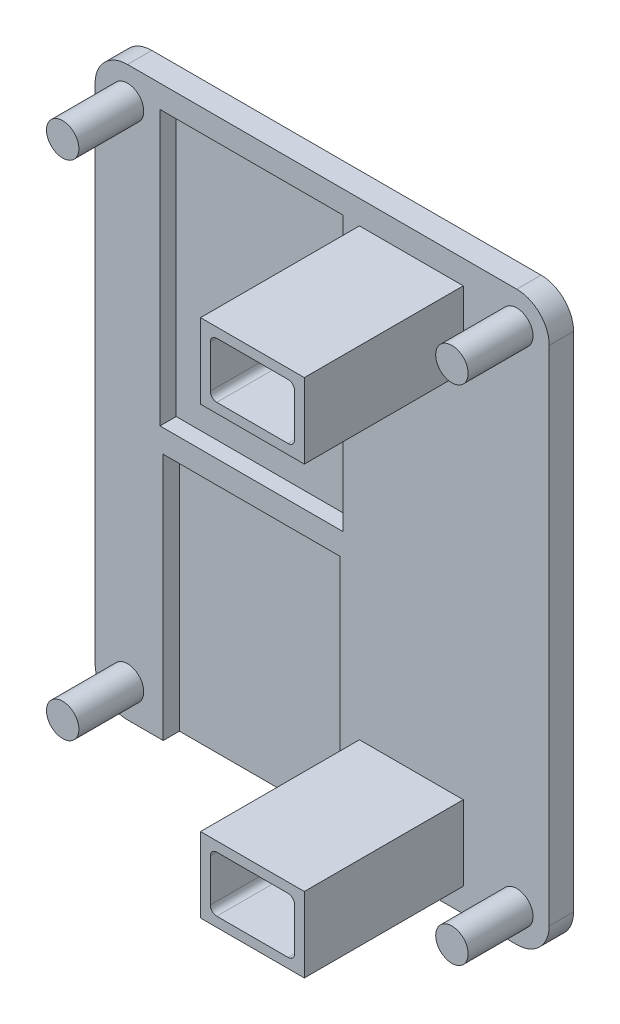
from build123d import *

# Parameters (mm, degrees)
BOSS_EXTRUDE1_DEPTH = 7.5
SKETCH3_W           = 56.5
SKETCH3_H           = 84.5
SKETCH3_W_2         = 54.5
SKETCH3_H_2         = 69.44
CUT_EXTRUDE1_DEPTH  = 5
SKETCH4_W           = 54.5
SKETCH4_H           = 9.636528607
CUT_EXTRUDE2_DEPTH  = 5
SKETCH5_W           = 32
SKETCH5_H           = 23.1
BOSS_EXTRUDE2_DEPTH = 49
SKETCH6_W           = 32
SKETCH6_H           = 23.1
BOSS_EXTRUDE3_DEPTH = 49
SKETCH7_R           = 5.000174567
BOSS_EXTRUDE4_DEPTH = 20


with BuildPart() as part:
    # Sketch2 → Boss-Extrude1 (new body)
    with BuildSketch(Plane.XY):
        with BuildLine():
            Line((-82.896774194, 76.290322581), (37.103225806, 76.290322581))
            ThreePointArc((37.103225806, 76.290322581), (44.174293618, 73.361390393), (47.103225806, 66.290322581))
            Line((47.103225806, 66.290322581), (47.103225806, -88.709677419))
            ThreePointArc((47.103225806, -88.709677419), (44.174293618, -95.780745231), (37.103225806, -98.709677419))
            Line((37.103225806, -98.709677419), (-82.896774194, -98.709677419))
            ThreePointArc((-82.896774194, -98.709677419), (-89.967842005, -95.780745231), (-92.896774194, -88.709677419))
            Line((-92.896774194, -88.709677419), (-92.896774194, 66.290322581))
            ThreePointArc((-92.896774194, 66.290322581), (-89.967842005, 73.361390393), (-82.896774194, 76.290322581))
        make_face()
    extrude(amount=BOSS_EXTRUDE1_DEPTH)

    # Sketch3 → Cut-Extrude1 (cut)
    with BuildSketch(Plane.XY.offset(7.5)):
        with Locations((-44.646774194, 27.040322581)):
            Rectangle(SKETCH3_W, SKETCH3_H)
        with Locations((-44.646774194, -56.989677419)):
            Rectangle(SKETCH3_W_2, SKETCH3_H_2)
    extrude(amount=-CUT_EXTRUDE1_DEPTH, mode=Mode.SUBTRACT)

    # Sketch4 → Cut-Extrude2 (cut)
    with BuildSketch(Plane.XY.offset(7.5)):
        with Locations((-44.646774194, -96.527941723)):
            Rectangle(SKETCH4_W, SKETCH4_H)
    extrude(amount=-CUT_EXTRUDE2_DEPTH, mode=Mode.SUBTRACT)

    # Sketch5 → Boss-Extrude2 (add)
    with BuildSketch(Plane.XY.offset(7.5)):
        with Locations((4.603225806, 57.39165706)):
            Rectangle(SKETCH5_W, SKETCH5_H)
        with BuildLine():
            Line((-6.396774194, 65.94165706), (15.603225806, 65.94165706))
            ThreePointArc((15.603225806, 65.94165706), (17.017439369, 65.355870623), (17.603225806, 63.94165706))
            Line((17.603225806, 63.94165706), (17.603225806, 50.84165706))
            ThreePointArc((17.603225806, 50.84165706), (17.017439369, 49.427443498), (15.603225806, 48.84165706))
            Line((15.603225806, 48.84165706), (-6.396774194, 48.84165706))
            ThreePointArc((-6.396774194, 48.84165706), (-7.810987756, 49.427443498), (-8.396774194, 50.84165706))
            Line((-8.396774194, 50.84165706), (-8.396774194, 63.94165706))
            ThreePointArc((-8.396774194, 63.94165706), (-7.810987756, 65.355870623), (-6.396774194, 65.94165706))
        make_face(mode=Mode.SUBTRACT)
    extrude(amount=BOSS_EXTRUDE2_DEPTH)

    # Sketch6 → Boss-Extrude3 (add)
    with BuildSketch(Plane.XY.offset(7.5)):
        with Locations((4.603225806, -79.809677419)):
            Rectangle(SKETCH6_W, SKETCH6_H)
        with BuildLine():
            Line((-6.396774194, -71.259677419), (15.603225806, -71.259677419))
            ThreePointArc((15.603225806, -71.259677419), (17.017439369, -71.845463857), (17.603225806, -73.259677419))
            Line((17.603225806, -73.259677419), (17.603225806, -86.359677419))
            ThreePointArc((17.603225806, -86.359677419), (17.017439369, -87.773890982), (15.603225806, -88.359677419))
            Line((15.603225806, -88.359677419), (-6.396774194, -88.359677419))
            ThreePointArc((-6.396774194, -88.359677419), (-7.810987756, -87.773890982), (-8.396774194, -86.359677419))
            Line((-8.396774194, -86.359677419), (-8.396774194, -73.259677419))
            ThreePointArc((-8.396774194, -73.259677419), (-7.810987756, -71.845463857), (-6.396774194, -71.259677419))
        make_face(mode=Mode.SUBTRACT)
    extrude(amount=BOSS_EXTRUDE3_DEPTH)

    # Sketch7 → Boss-Extrude4 (add)
    with BuildSketch(Plane.XY.offset(7.5)):
        with Locations((-82.896774194, 66.290322581)):
            Circle(SKETCH7_R)
        with Locations((37.103225806, 66.290322581)):
            Circle(SKETCH7_R)
        with Locations((-82.896774194, -88.709677419)):
            Circle(SKETCH7_R)
        with Locations((37.103225806, -88.709677419)):
            Circle(SKETCH7_R)
    extrude(amount=BOSS_EXTRUDE4_DEPTH)


solid = part.part
